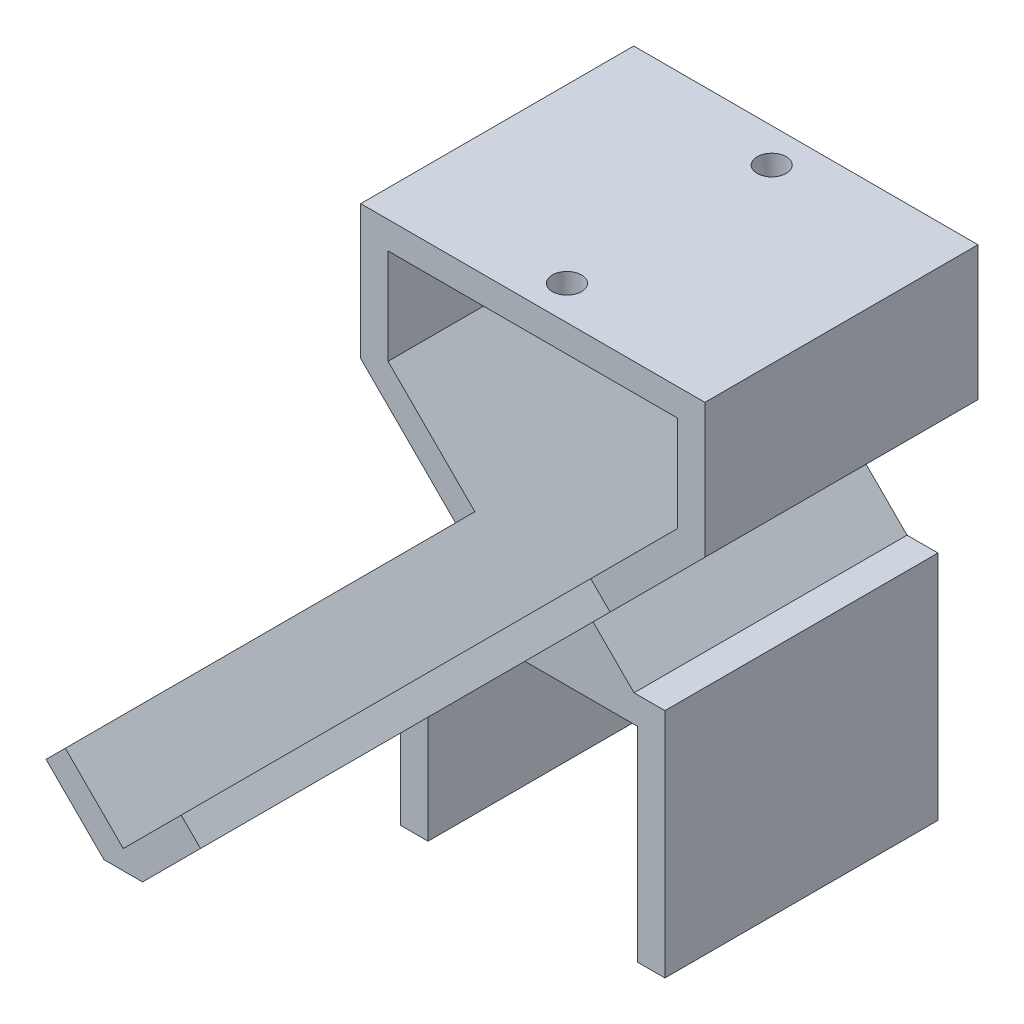
from build123d import *
from OCP.BRepFilletAPI import BRepFilletAPI_MakeChamfer

# Parameters (mm, degrees)
BOSS_EXTRUDE1_DEPTH       = 25.4
BOSS_EXTRUDE2_DEPTH       = 38.1
F_6_32_TAPPED_HOLE1_D     = 2.7051
F_6_32_TAPPED_HOLE1_DEPTH = 12.7
F_6_32_TAPPED_HOLE1_TIP   = 0.8126940302657266
CHAMFER1_SIZE             = 2.54
BOSS_EXTRUDE3_DEPTH       = 25.4
CHAMFER2_SIZE             = 7.619999999999999
CHAMFER2_SIZE2            = 5.388153672641502


with BuildPart() as part:
    # Sketch1 → Boss-Extrude1 (new body)
    with BuildSketch(Plane.XY):
        Polygon((0, -3.592102448427662), (-16.01038418160373, 12.418281733176066), (-16.010384181603733, 24.90038418160373), (16.01038418160373, 24.90038418160373), (16.010384181603733, 12.418281733176075), align=None)
        Polygon((0, 0), (-13.47038418160373, 13.47038418160373), (-13.470384181603732, 22.360384181603727), (13.470384181603732, 22.360384181603727), (13.47038418160373, 13.47038418160373), align=None, mode=Mode.SUBTRACT)
    extrude(amount=BOSS_EXTRUDE1_DEPTH)

    # Sketch2 → Boss-Extrude2 (add)
    with BuildSketch(Plane.XY.offset(25.4)):
        Polygon((0, 0), (-5.388153672641493, 5.388153672641493), (-7.184204896855324, 3.592102448427661), (0, -3.592102448427662), (7.184204896855322, 3.5921024484276627), (5.388153672641491, 5.3881536726414945), align=None)
    extrude(amount=BOSS_EXTRUDE2_DEPTH)

    # #6-32 Tapped Hole1
    with Locations(Plane(origin=(0, 24.90038418160373, 0), x_dir=(1, 0, 0), z_dir=(0, 1, 0))):
        with Locations((0, -3.175), (0, -22.225)):
            Hole(F_6_32_TAPPED_HOLE1_D / 2, depth=F_6_32_TAPPED_HOLE1_DEPTH)
            with Locations((0, 0, -(F_6_32_TAPPED_HOLE1_DEPTH + F_6_32_TAPPED_HOLE1_TIP / 2))):  # 118° drill point
                Cone(0, F_6_32_TAPPED_HOLE1_D / 2, F_6_32_TAPPED_HOLE1_TIP, mode=Mode.SUBTRACT)

    # Chamfer1
    chamfer1_edges = [part.edges().sort_by_distance(p)[0] for p in [
        (0, -3.592102448427662, 31.75),
    ]]
    chamfer(chamfer1_edges, length=CHAMFER1_SIZE)

    # Sketch5 → Boss-Extrude3 (add)
    with BuildSketch(Plane(origin=(0, 0, 0), x_dir=(-1, 0, 0), z_dir=(0, 0, -1))):
        Polygon((1.7960512242138398, -1.7960512242138225), (-1.7960512242138331, -1.7960512242138298), (-12.29, -1.796051224213831), (-12.289999999999996, -23.336051224213833), (-9.749999999999998, -23.336051224213833), (-9.749999999999998, -4.336051224213831), (9.749999999999998, -4.336051224213828), (9.750000000000005, -23.33605122421383), (12.290000000000003, -23.33605122421383), (12.29, -1.796051224213828), align=None)
    extrude(amount=-BOSS_EXTRUDE3_DEPTH)

    # Chamfer2: one chamfer whose edges measure the first distance from different faces: ONE call of the kernel's chamfer builder (chamfer() names one face for all edges)
    chamfer2_edges_1 = [part.edges().sort_by_distance(p)[0] for p in [
        (1.7960512242138322, -1.7960512242138291, 12.7),
    ]]
    chamfer2_side_1 = [part.faces().sort_by_distance(p)[0] for p in [
        (7.0430256121069155, -1.7960512242138404, 12.7),
    ]]
    chamfer2_edges_2 = [part.edges().sort_by_distance(p)[0] for p in [
        (-1.7960512242138293, -1.7960512242138293, 12.7),
    ]]
    chamfer2_side_2 = [part.faces().sort_by_distance(p)[0] for p in [
        (-7.043025612106914, -1.7960512242138118, 12.7),
    ]]
    chamfer2 = BRepFilletAPI_MakeChamfer(part.part.solid().wrapped)
    for e in chamfer2_edges_1:
        chamfer2.Add(CHAMFER2_SIZE, CHAMFER2_SIZE2, e.wrapped, chamfer2_side_1[0].wrapped)  # the first distance lies on this face
    for e in chamfer2_edges_2:
        chamfer2.Add(CHAMFER2_SIZE, CHAMFER2_SIZE2, e.wrapped, chamfer2_side_2[0].wrapped)  # the first distance lies on this face
    add(Compound.cast(chamfer2.Shape()), mode=Mode.REPLACE)


solid = part.part
